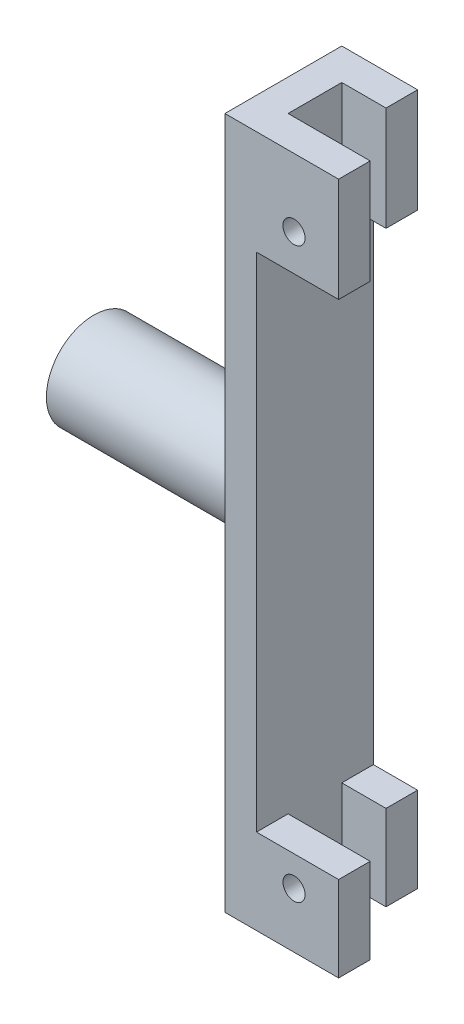
from build123d import *

# Parameters (mm, degrees)
SKETCH_1_W           = 36
SKETCH_1_H           = 219
EXTRUDE_1_DEPTH      = 37
SKETCH_2_W           = 80.767995678
SKETCH_2_H           = 159
CUT_EXTRUDE_1_DEPTH  = 117.975424769
CUT_EXTRUDE_START    = 10
SKETCH_9_W           = 26
SKETCH_9_H           = 219
CUT_EXTRUDE_7_DEPTH  = 17
SKETCH_10_W          = 12
SKETCH_10_H          = 236
CUT_EXTRUDE_8_DEPTH  = 17
CUT_EXTRUDE_START_2  = 37
SKETCH_11_R          = 3.5
CUT_EXTRUDE_11_DEPTH = 17
SKETCH_25_R          = 15
EXTRUDE_3_DEPTH      = 60
CUT_EXTRUDE_START_3  = -78
SKETCH_26_R          = 11
CUT_EXTRUDE_13_DEPTH = 3


with BuildPart() as part:
    # 스케치1 → 보스-돌출1 (new body)
    with BuildSketch(Plane.XY):
        Rectangle(SKETCH_1_W, SKETCH_1_H)
    extrude(amount=EXTRUDE_1_DEPTH)

    # 스케치2 → 컷-돌출1 (cut, through all)
    with BuildSketch(Plane.XY):
        with Locations((32.383997839, -3)):
            Rectangle(SKETCH_2_W, SKETCH_2_H)
    extrude(amount=CUT_EXTRUDE_1_DEPTH, mode=Mode.SUBTRACT)

    # 스케치9 → 컷-돌출7 (cut)
    with BuildSketch(Plane.XY.offset(CUT_EXTRUDE_START)):
        with Locations((5, 0)):
            Rectangle(SKETCH_9_W, SKETCH_9_H)
    extrude(amount=CUT_EXTRUDE_7_DEPTH, mode=Mode.SUBTRACT)

    # 스케치10 → 컷-돌출8 (cut)
    with BuildSketch(Plane.XY):
        with Locations((12, 8.5)):
            Rectangle(SKETCH_10_W, SKETCH_10_H)
    extrude(amount=CUT_EXTRUDE_8_DEPTH, mode=Mode.SUBTRACT)

    # 스케치11 → 컷-돌출11 (cut)
    with BuildSketch(Plane.XY.offset(CUT_EXTRUDE_START_2)):
        with Locations((3.878169626, 88)):
            Circle(SKETCH_11_R)
        with Locations((3.878169626, -92)):
            Circle(SKETCH_11_R)
    extrude(amount=-CUT_EXTRUDE_11_DEPTH, mode=Mode.SUBTRACT)

    # 스케치25 → 보스-돌출3 (add)
    with BuildSketch(Plane.ZY.offset(18)):
        with Locations(Location((18.5, 0, 0), (0, 0, 180))):
            Circle(SKETCH_25_R)
    extrude(amount=EXTRUDE_3_DEPTH)

    # 스케치26 → 컷-돌출13 (cut)
    with BuildSketch(Plane(origin=(0, 0, 0), x_dir=(0, 0, -1), z_dir=(1, 0, 0)).offset(CUT_EXTRUDE_START_3)):
        with Locations(Location((-18.5, 0, 0), (0, 0, 180))):
            Circle(SKETCH_26_R)
    extrude(amount=CUT_EXTRUDE_13_DEPTH, mode=Mode.SUBTRACT)


solid = part.part
